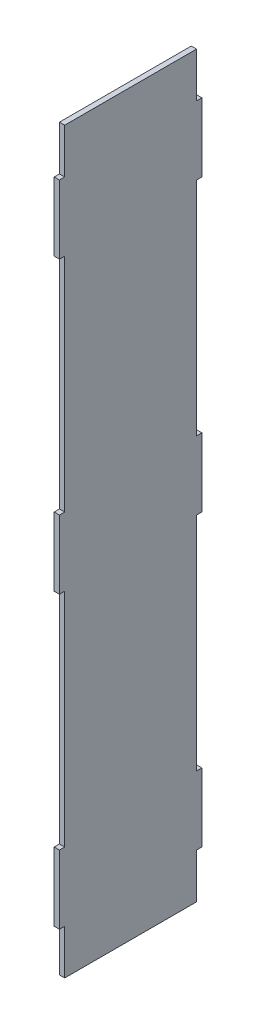
from build123d import *

# Parameters (mm, degrees)
BOSS_EXTRUDE1_DEPTH = 1


with BuildPart() as part:
    # Sketch1 → Boss-Extrude1 (new body)
    with BuildSketch(Plane(origin=(0, 0, 0), x_dir=(0, 0, -1), z_dir=(1, 0, 0))):
        Polygon((-12.5, 61.5), (-13.5, 61.5), (-13.5, 48.5), (-12.5, 48.5), (-12.5, 6.5), (-13.5, 6.5), (-13.5, -6.5), (-12.5, -6.5), (-12.5, -48.5), (-13.5, -48.5), (-13.5, -61.5), (-12.5, -61.5), (-12.5, -70), (12.5, -70), (12.5, -61.5), (13.5, -61.5), (13.5, -48.5), (12.5, -48.5), (12.5, -6.5), (13.5, -6.5), (13.5, 6.5), (12.5, 6.5), (12.5, 48.5), (13.5, 48.5), (13.5, 61.5), (12.5, 61.5), (12.5, 70), (-12.5, 70), align=None)
    extrude(amount=BOSS_EXTRUDE1_DEPTH)


solid = part.part
